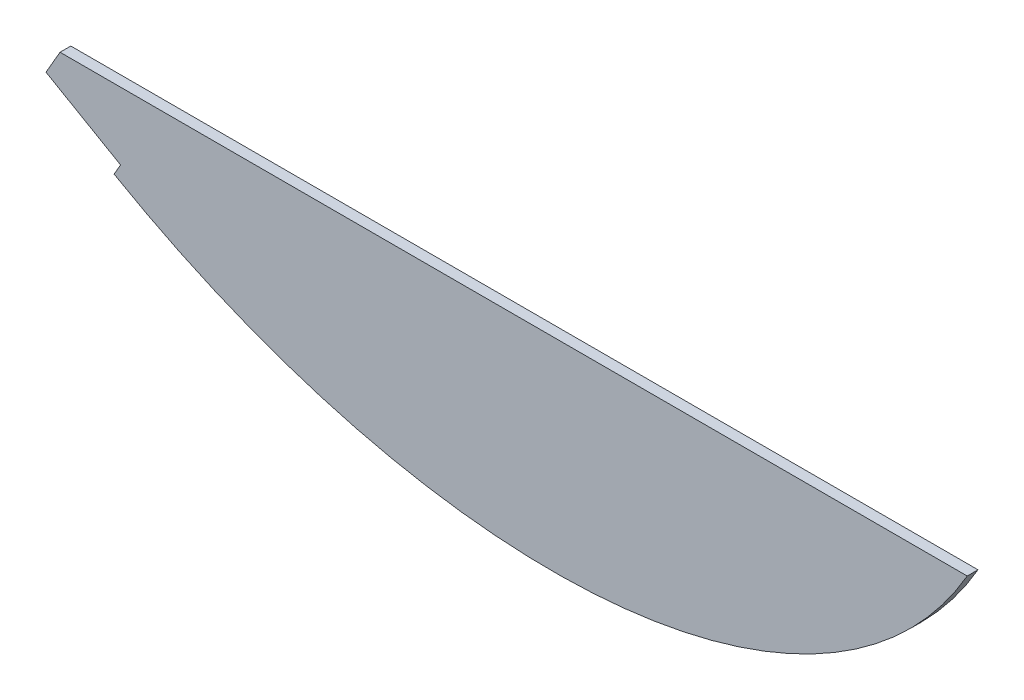
from build123d import *

# Parameters (mm, degrees)
BOSS_EXTRUDE1_DEPTH = 5
CUT_EXTRUDE2_DEPTH  = 274.862320579
CUT_EXTRUDE3_REACH  = 268.706
SKETCH4_W           = 22.592590208
SKETCH4_H           = 5
CUT_EXTRUDE4_DEPTH  = 251.628305478


with BuildPart() as part:
    # Sketch1 → Boss-Extrude1 (new body)
    with BuildSketch(Plane.XY):
        Polygon((-99.840598923, -66.910346562), (128.800871466, -66.910346562), (186.535898385, 33.089653438), (-263.00567968, 33.089653438), (-265.51567968, 28.742205911), align=None)
    extrude(amount=BOSS_EXTRUDE1_DEPTH)

    # Sketch3 → Cut-Extrude2 (cut, through all)
    with BuildSketch(Plane.XY):
        Polygon((-209.838906471, -3.402794089), (-265.51567968, 28.742205911), (-262.51567968, 33.938358334), (-206.838906471, 1.793358334), align=None)
    extrude(amount=CUT_EXTRUDE2_DEPTH, mode=Mode.SUBTRACT)

    # Sketch4 → Cut-Extrude3 (cut, up to next)
    with BuildSketch(Plane(origin=(-50.93317968, -88.218854997, 0), x_dir=(0.8660254037844388, -0.4999999999999997, 0), z_dir=(-0.49999999999999983, -0.8660254037844389, 0)), mode=Mode.PRIVATE) as cut_extrude3_sk1:
        with Locations((-231.320721766, 2.5)):
            Rectangle(SKETCH4_W, SKETCH4_H)
    cut_extrude3_tool1 = extrude(cut_extrude3_sk1.sketch, amount=-CUT_EXTRUDE3_REACH, mode=Mode.PRIVATE) & part.part
    add(cut_extrude3_tool1.solids().sort_by_distance((-251.262801, 27.441506, 2.5))[0], mode=Mode.SUBTRACT)

    # Sketch5 → Cut-Extrude4 (cut, through all)
    with BuildSketch(Plane.XY):
        with BuildLine():
            Line((-209.838906471, -3.402794089), (71.640503869, -165.91500742))
            Line((71.640503869, -165.91500742), (186.535898385, 33.089653438))
            add(Edge.make_bspline(
                [(-209.838906471, -3.402794089), (71.640503869, -165.91500742), (186.535898385, 33.089653438)],
                knots=[4.71238898, 4.71238898, 4.71238898, 6.283185307, 6.283185307, 6.283185307], degree=2, weights=[1, 0.707106781, 1]))
        make_face()
    extrude(amount=CUT_EXTRUDE4_DEPTH, mode=Mode.SUBTRACT)


solid = part.part
